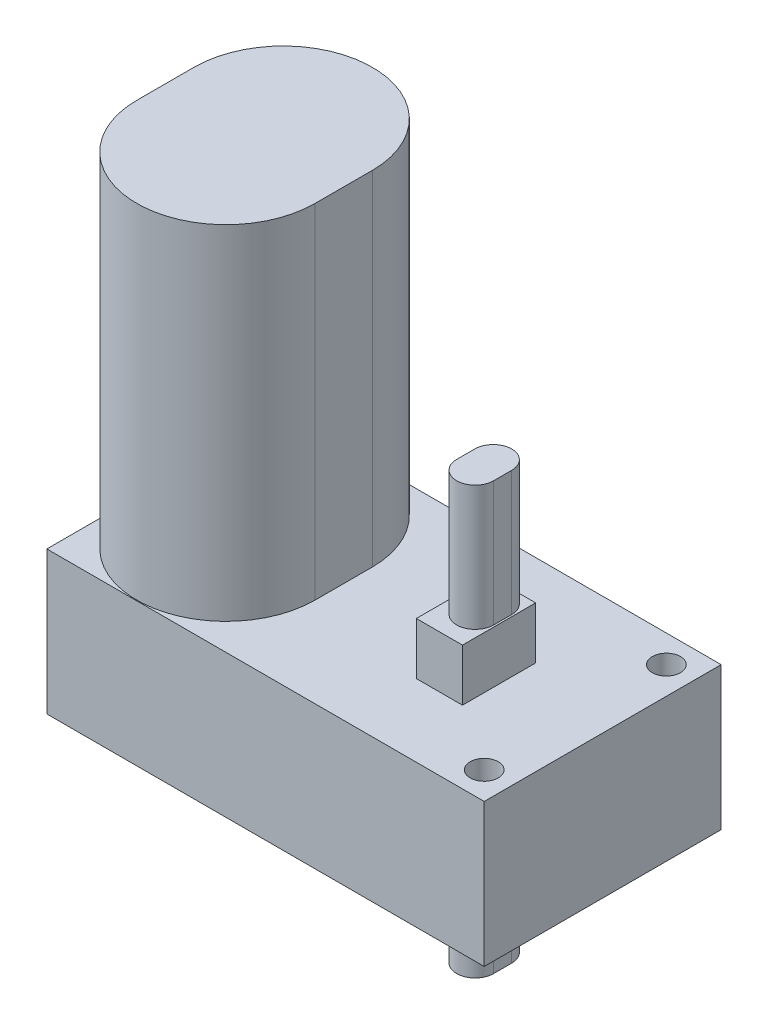
from build123d import *

# Parameters (mm, degrees)
SKETCH1_W                = 42.01
SKETCH1_H                = 22.76
BOSS_EXTRUDE1_DEPTH      = 13.73
BOSS_EXTRUDE2_DEPTH      = 33
BOSS_EXTRUDE3_DEPTH      = 17
BOSS_EXTRUDE3_DEPTH_BACK = 24
SKETCH4_R                = 1.35
CUT_EXTRUDE1_DEPTH       = 17
SKETCH5_W                = 4.431132328
SKETCH5_H                = 7.028163836
BOSS_EXTRUDE4_DEPTH      = 5


with BuildPart() as part:
    # Sketch1 → Boss-Extrude1 (new body)
    with BuildSketch(Plane(origin=(0, 0, 0), x_dir=(1, 0, 0), z_dir=(0, 1, 0))):
        Rectangle(SKETCH1_W, SKETCH1_H)
    extrude(amount=BOSS_EXTRUDE1_DEPTH)

    # Sketch2 → Boss-Extrude2 (add)
    with BuildSketch(Plane(origin=(0, 13.73, 0), x_dir=(1, 0, 0), z_dir=(0, 1, 0))):
        with BuildLine():
            Line((-21.005, -2.75), (-21.005, 2.75))
            ThreePointArc((-21.005, 2.75), (-12.435, 11.32), (-3.865, 2.75))
            Line((-3.865, 2.75), (-3.865, -2.75))
            ThreePointArc((-3.865, -2.75), (-12.435, -11.32), (-21.005, -2.75))
        make_face()
    extrude(amount=BOSS_EXTRUDE2_DEPTH)

    # Sketch3 → Boss-Extrude3 (add, two sides: drawn at the far end of the back side and taken through both)
    with BuildSketch(Plane(origin=(0, 13.73, 0), x_dir=(1, 0, 0), z_dir=(0, 1, 0)).offset(-BOSS_EXTRUDE3_DEPTH_BACK)):
        with BuildLine():
            Line((8.23, -1.25), (8.23, 0.49))
            ThreePointArc((8.23, 0.49), (10.005, 2.265), (11.78, 0.49))
            Line((11.78, 0.49), (11.78, -1.25))
            ThreePointArc((11.78, -1.25), (10.005, -3.025), (8.23, -1.25))
        make_face()
    extrude(amount=BOSS_EXTRUDE3_DEPTH + BOSS_EXTRUDE3_DEPTH_BACK)

    # Sketch4 → Cut-Extrude1 (cut)
    with BuildSketch(Plane(origin=(0, 13.73, 0), x_dir=(1, 0, 0), z_dir=(0, 1, 0))):
        with Locations(Location((18.375, 8.75, 0), (0, 0, 270))):
            Circle(SKETCH4_R)
        with Locations(Location((18.375, -8.75, 0), (0, 0, 270))):
            Circle(SKETCH4_R)
    extrude(amount=-CUT_EXTRUDE1_DEPTH, mode=Mode.SUBTRACT)

    # Sketch5 → Boss-Extrude4 (add)
    with BuildSketch(Plane(origin=(0, 13.73, 0), x_dir=(1, 0, 0), z_dir=(0, 1, 0))):
        with Locations((9.740065893, -0.904904843)):
            Rectangle(SKETCH5_W, SKETCH5_H)
    extrude(amount=BOSS_EXTRUDE4_DEPTH)


solid = part.part
